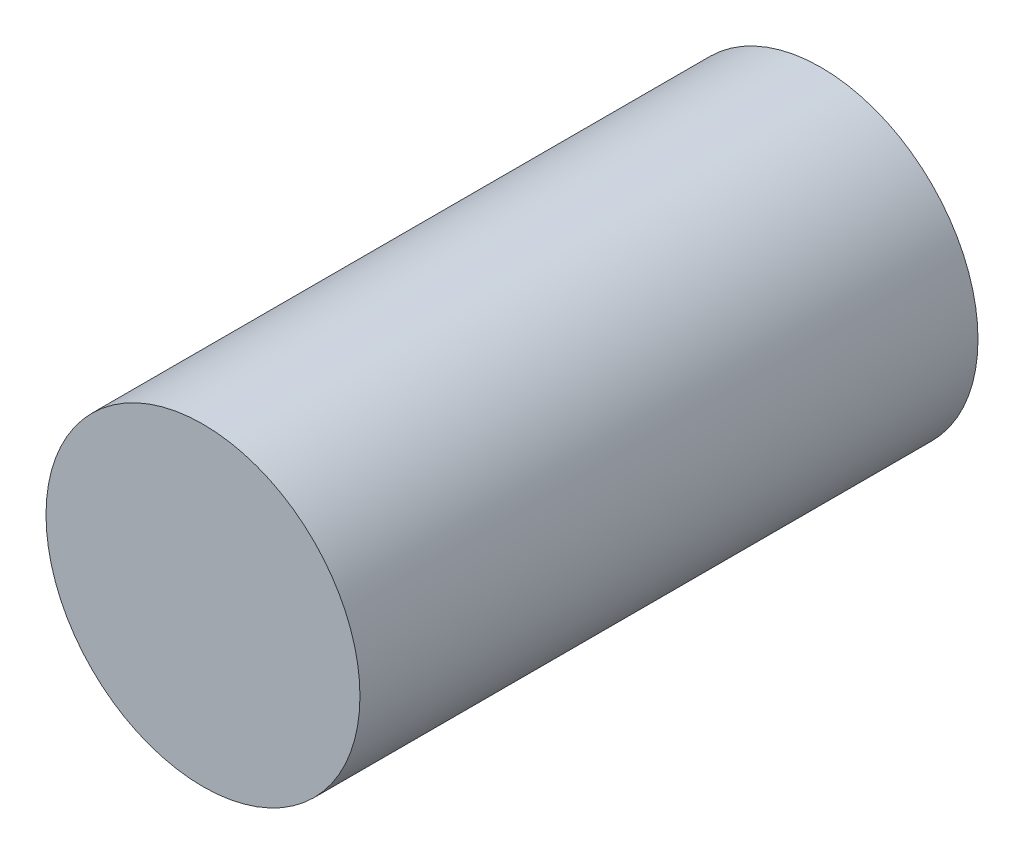
from build123d import *

# Parameters (mm, degrees)
SKETCH1_R           = 12.7
BOSS_EXTRUDE1_DEPTH = 50


with BuildPart() as part:
    # Sketch1 → Boss-Extrude1 (new body)
    with BuildSketch(Plane.XY):
        Circle(SKETCH1_R)
    extrude(amount=BOSS_EXTRUDE1_DEPTH)


solid = part.part
